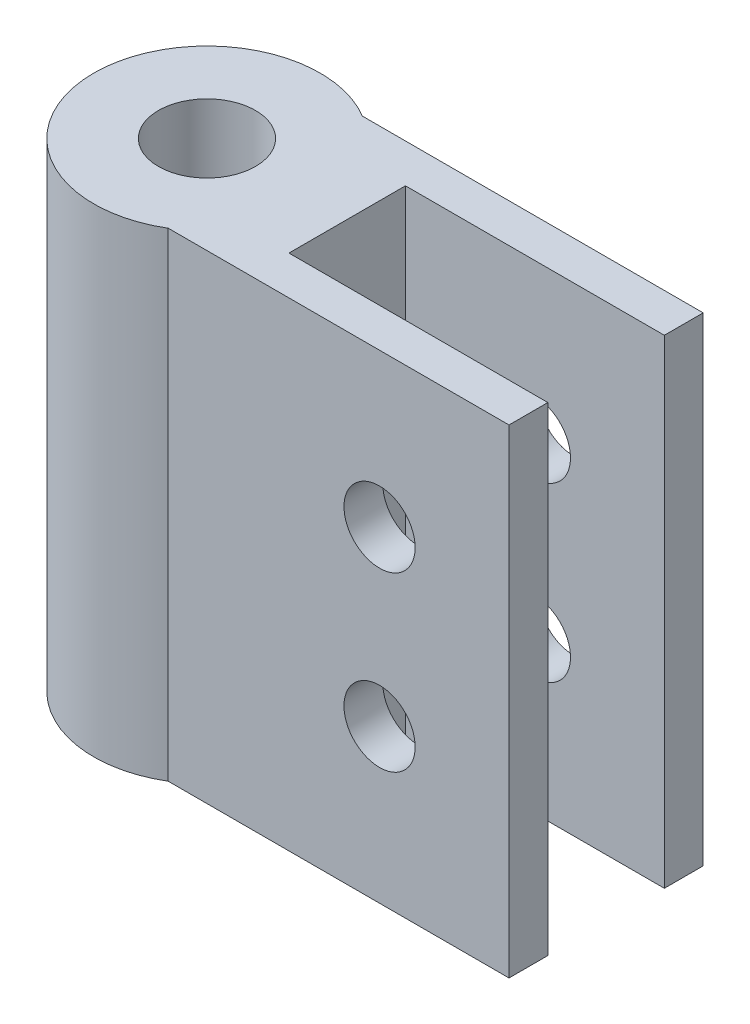
from build123d import *

# Parameters (mm, degrees)
SKETCH_1_R          = 5.25
SKETCH_1_R_2        = 2.25
EXTRUDE_1_DEPTH     = 22.2
SKETCH_2_W          = 16
SKETCH_2_H          = 9
EXTRUDE_2_DEPTH     = 22.2
SKETCH_3_W          = 12
SKETCH_3_H          = 5.4
CUT_EXTRUDE_1_DEPTH = 30.370946529
SKETCH_4_R          = 1.65
CUT_EXTRUDE_2_DEPTH = 22


with BuildPart() as part:
    # 草图1 → 凸台-拉伸1 (new body)
    with BuildSketch(Plane(origin=(0, 0, 0), x_dir=(1, 0, 0), z_dir=(0, 1, 0))):
        with Locations(Location((0, 0, 0), (0, 0, 270))):
            Circle(SKETCH_1_R)
        with Locations(Location((0, 0, 0), (0, 0, 270))):
            Circle(SKETCH_1_R_2, mode=Mode.SUBTRACT)
    extrude(amount=EXTRUDE_1_DEPTH)

    # 草图2 → 凸台-拉伸2 (add)
    with BuildSketch(Plane(origin=(0, 22.2, 0), x_dir=(1, 0, 0), z_dir=(0, 1, 0))):
        with Locations((10.5, 0)):
            Rectangle(SKETCH_2_W, SKETCH_2_H)
    extrude(amount=-EXTRUDE_2_DEPTH)

    # 草图3 → 切除-拉伸1 (cut, through all)
    with BuildSketch(Plane(origin=(0, 22.2, 0), x_dir=(1, 0, 0), z_dir=(0, 1, 0))):
        with Locations((12.5, 0)):
            Rectangle(SKETCH_3_W, SKETCH_3_H)
    extrude(amount=-CUT_EXTRUDE_1_DEPTH, mode=Mode.SUBTRACT)

    # 草图4 → 切除-拉伸2 (cut)
    with BuildSketch(Plane.XY.offset(4.5)):
        with Locations(Location((12.5, 15.1, 0), (0, 0, 180))):
            Circle(SKETCH_4_R)
        with Locations(Location((12.5, 7.1, 0), (0, 0, 180))):
            Circle(SKETCH_4_R)
    extrude(amount=-CUT_EXTRUDE_2_DEPTH, mode=Mode.SUBTRACT)


solid = part.part
